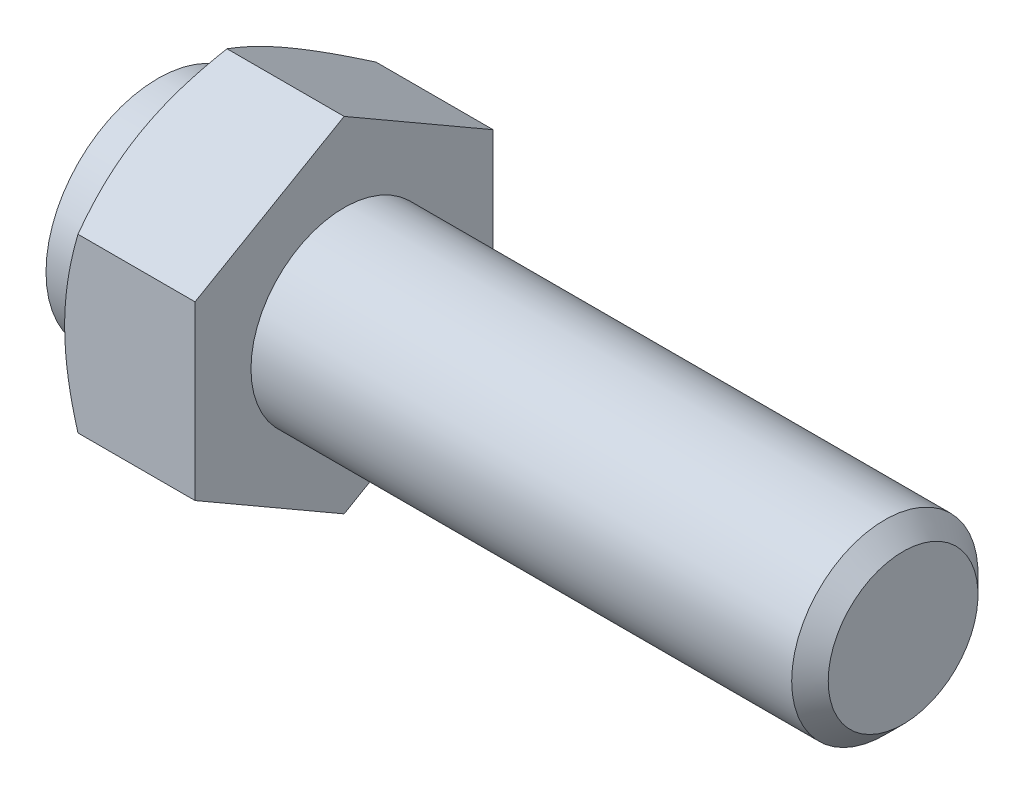
from build123d import *

# Parameters (mm, degrees)
SKETCH_2_W          = 18.4
SKETCH_2_H          = 18.4
CUT_EXTRUDE_1_DEPTH = 5


with BuildPart() as part:
    # 草图1 → 旋转1 (revolve)
    with BuildSketch(Plane.XY):
        Polygon((-5, 0), (-5, 3), (-3.5, 3), (-3.5, 4), (-3.038119785, 4.8), (0, 4.8), (0, 2.5), (14.5095, 2.5), (15, 2.0095), (15, 0), align=None)
    revolve(axis=Axis((15, 0, 0), (-1, 0, 0)))

    # 草图2 → 切除-拉伸1 (cut)
    with BuildSketch(Plane(origin=(0, 0, 0), x_dir=(0, 0, -1), z_dir=(1, 0, 0))):
        Rectangle(SKETCH_2_W, SKETCH_2_H)
        Polygon((-4, 2.309401077), (-4, -2.309401077), (0, -4.618802154), (4, -2.309401077), (4, 2.309401077), (0, 4.618802154), align=None, mode=Mode.SUBTRACT)
    extrude(amount=-CUT_EXTRUDE_1_DEPTH, mode=Mode.SUBTRACT)


solid = part.part
